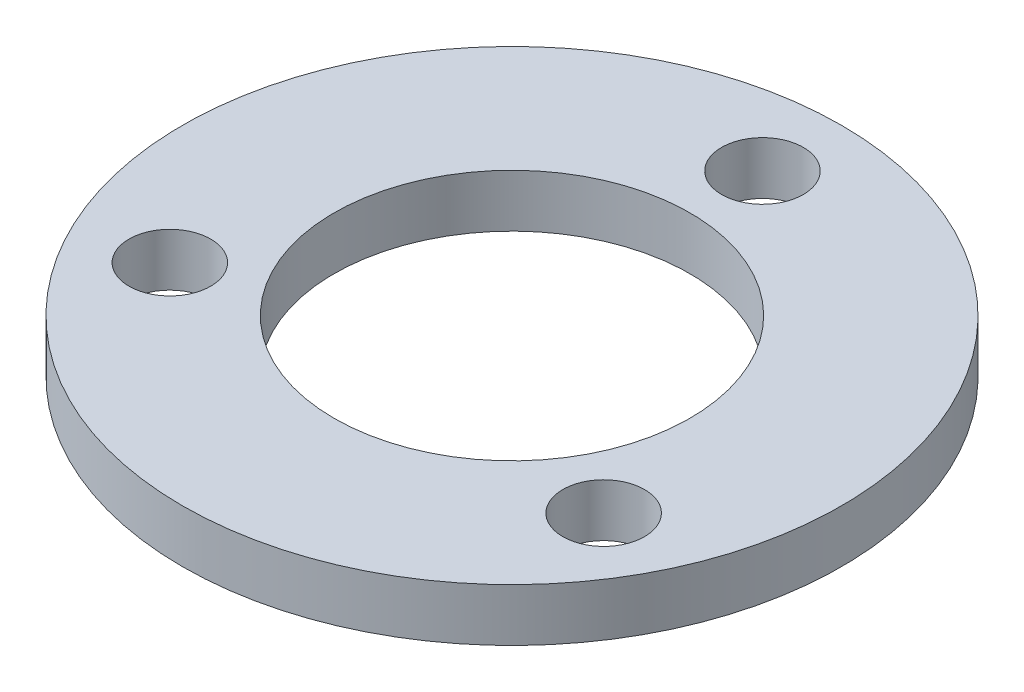
from build123d import *

# Parameters (mm, degrees)
SKETCH_2_R          = 12.5
SKETCH_2_R_2        = 6.75
EXTRUDE_1_DEPTH     = 2
SKETCH_3_R          = 1.55
CUT_EXTRUDE_1_DEPTH = 18.790446875


with BuildPart() as part:
    # 草图2 → 凸台-拉伸1 (new body)
    with BuildSketch(Plane(origin=(0, 0, 0), x_dir=(1, 0, 0), z_dir=(0, 1, 0))):
        with Locations(Location((0, 0, 0), (0, 0, 270))):
            Circle(SKETCH_2_R)
        with Locations(Location((0, 0, 0), (0, 0, 270))):
            Circle(SKETCH_2_R_2, mode=Mode.SUBTRACT)
    extrude(amount=EXTRUDE_1_DEPTH)

    # 草图3 → 切除-拉伸1 (cut, through all)
    with BuildSketch(Plane(origin=(0, 2, 0), x_dir=(1, 0, 0), z_dir=(0, 1, 0))):
        with Locations(Location((0, 9.5, 0), (0, 0, 270))):
            Circle(SKETCH_3_R)
        with Locations(Location((8.227241336, -4.75, 0), (0, 0, 270))):
            Circle(SKETCH_3_R)
        with Locations(Location((-8.227241336, -4.75, 0), (0, 0, 270))):
            Circle(SKETCH_3_R)
    extrude(amount=-CUT_EXTRUDE_1_DEPTH, mode=Mode.SUBTRACT)


solid = part.part
